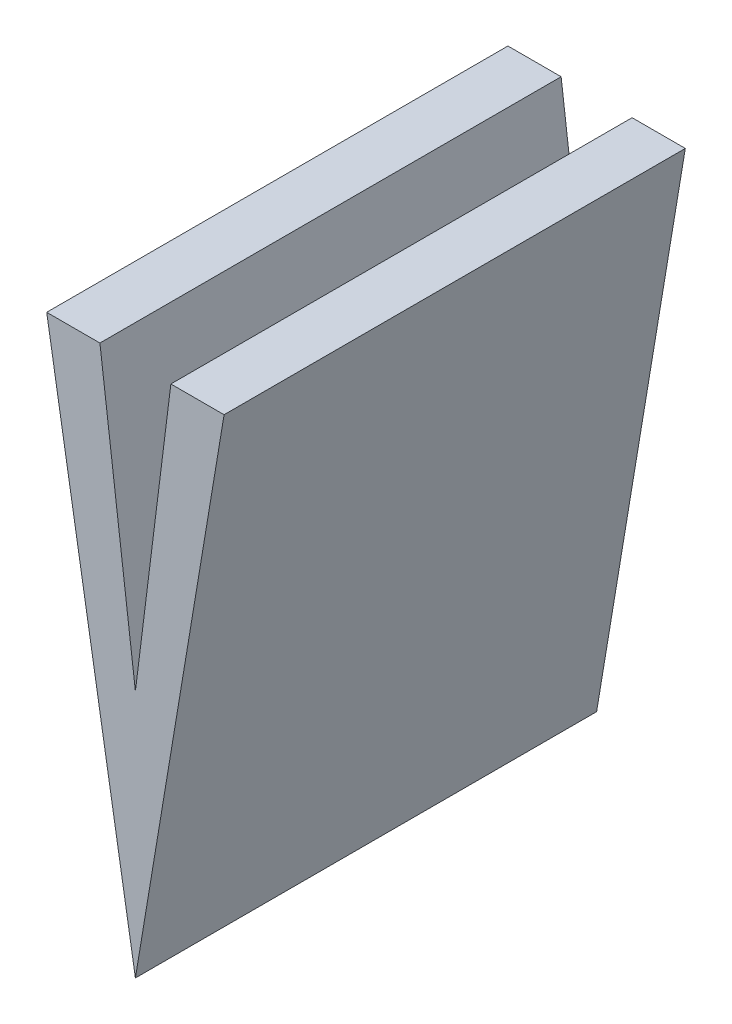
from build123d import *

# Parameters (mm, degrees)
BOSS_EXTRUDE1_DEPTH = 26


with BuildPart() as part:
    # Sketch1 → Boss-Extrude1 (new body)
    with BuildSketch(Plane.XY):
        Polygon((2, 30), (5, 30), (0, 0), (-5, 30), (-2, 30), (0, 14), align=None)
    extrude(amount=BOSS_EXTRUDE1_DEPTH)


solid = part.part
